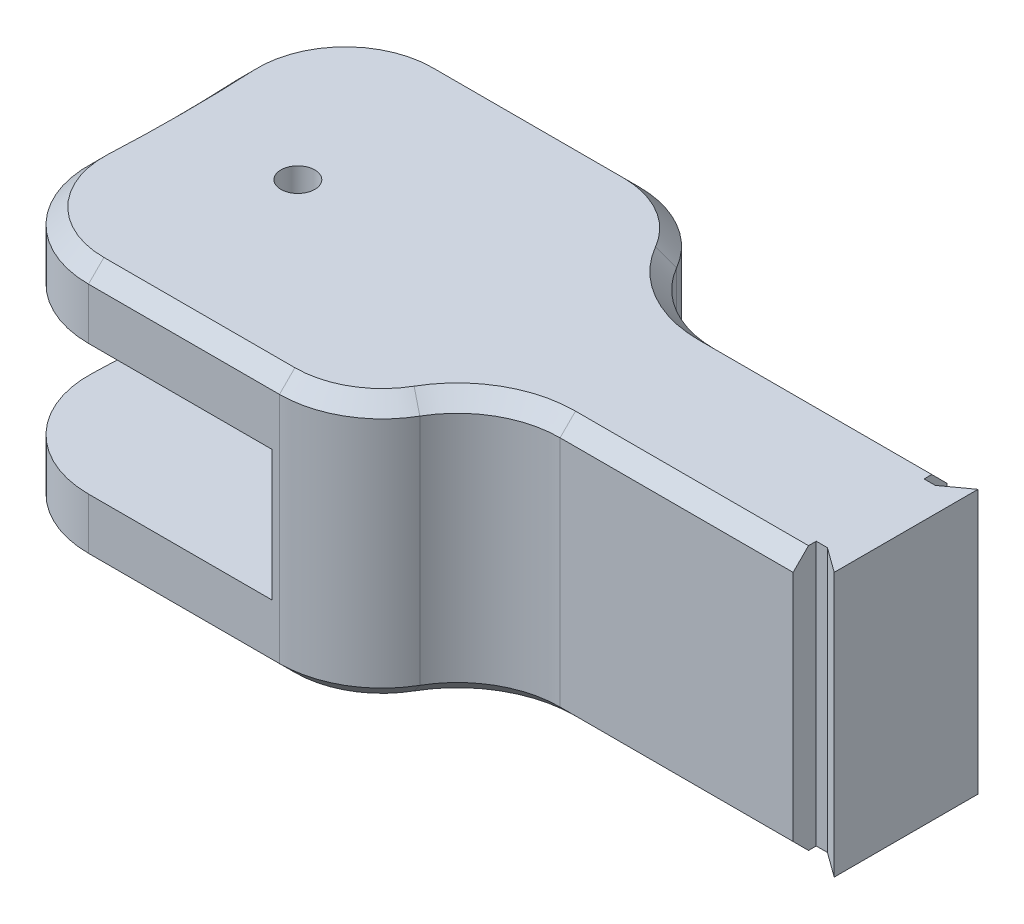
from build123d import *

# Parameters (mm, degrees)
SKETCH2_OUTSIDE_W     = 472.576
SKETCH2_OUTSIDE_H     = 472.576
SKETCH2_OUTSIDE_W_2   = 39.636477918
SKETCH2_OUTSIDE_H_2   = 35
CUT_EXTRUDE1_DEPTH    = 377.781288533
BOSS_EXTRUDE1_DEPTH   = 25.7
BOSS_EXTRUDE2_DEPTH   = 25.7
FILLET1_R             = 10
M4X0_7_TAPPED_HOLE1_D = 3.3
FILLET2_R             = 10
CHAMFER1_SIZE         = 1.5


with BuildPart() as part:
    # Sketch1 → Revolve1 (revolve)
    with BuildSketch(Plane.XY, mode=Mode.PRIVATE) as revolve1_sk:
        Polygon((0, 0), (28.575, 0), (28.575, 12.7), (0, 12.7), (0, 19.2), (38.575, 19.2), (38.575, -6.5), (0, -6.5), align=None)
    revolve(revolve1_sk.sketch.rotate(Axis((-144.78715491, 19.2, 0), (0, -1, 0)), 90), axis=Axis((-144.78715491, 19.2, 0), (0, -1, 0)))

    # Sketch2 outside → Cut-Extrude1 (cut, through all)
    with BuildSketch(Plane(origin=(0, 19.2, 0), x_dir=(1, 0, 0), z_dir=(0, 1, 0))):
        with Locations((-144.787, 0)):
            Rectangle(SKETCH2_OUTSIDE_W, SKETCH2_OUTSIDE_H)
        with Locations((18.756761041, 0)):
            Rectangle(SKETCH2_OUTSIDE_W_2, SKETCH2_OUTSIDE_H_2, mode=Mode.SUBTRACT)
    extrude(amount=-CUT_EXTRUDE1_DEPTH, mode=Mode.SUBTRACT)

    # Sketch3 → Boss-Extrude1 (add, through all)
    with BuildSketch(Plane(origin=(0, 19.2, 0), x_dir=(1, 0, 0), z_dir=(0, 1, 0))):
        with BuildLine():
            Line((38.421550814, 7.5), (68.421550814, 7.5))
            Line((68.421550814, 7.5), (68.421550814, -7.5))
            Line((68.421550814, -7.5), (38.421550814, -7.5))
            ThreePointArc((38.421550814, -7.5), (38.575, 0), (38.421550814, 7.5))
        make_face()
    extrude(amount=-BOSS_EXTRUDE1_DEPTH)

    # Sketch4 → Boss-Extrude2 (add, through all)
    with BuildSketch(Plane(origin=(0, 19.2, 0), x_dir=(1, 0, 0), z_dir=(0, 1, 0))):
        Polygon((71.921550814, 7), (71.921550814, -7), (69.511550814, -5.25), (68.421550814, -5.25), (68.421550814, 5.25), (69.511550814, 5.25), align=None)
    extrude(amount=-BOSS_EXTRUDE2_DEPTH)

    # Fillet1
    fillet1_edges = [part.edges().sort_by_distance(p)[0] for p in [
        (-1.061477918, 15.95, 17.5),
        (-1.061477918, -3.25, 17.5),
        (-1.061477918, -3.25, -17.5),
        (-1.061477918, 15.95, -17.5),
        (37.73799364, 6.35, -17.5),
        (37.73799364, 6.35, 17.5),
    ]]
    fillet(fillet1_edges, radius=FILLET1_R)

    # M4x0.7 Tapped Hole1 (through all)
    with Locations(Plane(origin=(0, 19.2, 0), x_dir=(1, 0, 0), z_dir=(0, 1, 0))):
        with Locations((12.7, 0)):
            Hole(M4X0_7_TAPPED_HOLE1_D / 2)

    # Fillet2
    fillet2_edges = [part.edges().sort_by_distance(p)[0] for p in [
        (38.421550814, 6.35, 7.5),
        (38.421550814, 6.35, -7.5),
    ]]
    fillet(fillet2_edges, radius=FILLET2_R)

    # Chamfer1
    chamfer1_edges = [part.edges().sort_by_distance(p)[0] for p in [
        (19.115441742, 19.2, 17.5),
        (2.577841169, 19.2, 14.397631358),
        (2.577841169, 19.2, -14.397631358),
        (33.41269138, 19.2, 16.160254038),
        (33.41269138, -6.5, 16.160254038),
        (57.077375135, 19.2, 7.5),
        (57.077375135, -6.5, 7.5),
        (33.41269138, 19.2, -16.160254038),
        (40.733199456, 19.2, 8.839745962),
        (40.733199456, -6.5, 8.839745962),
        (40.733199456, 19.2, -8.839745962),
        (40.733199456, -6.5, -8.839745962),
        (57.077375135, -6.5, -7.5),
        (57.077375135, 19.2, -7.5),
        (19.115441742, 19.2, -17.5),
        (19.115441742, -6.5, -17.5),
        (19.115441742, -6.5, 17.5),
        (0, -6.5, 0),
        (2.577841169, -6.5, 14.397631358),
        (2.577841169, -6.5, -14.397631358),
        (33.41269138, -6.5, -16.160254038),
        (0, 19.2, 0),
    ]]
    chamfer(chamfer1_edges, length=CHAMFER1_SIZE)


solid = part.part
